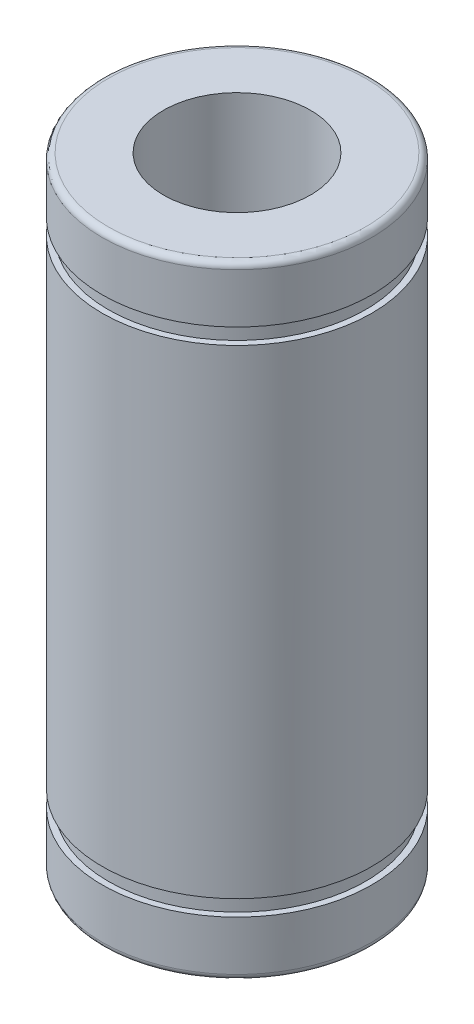
from build123d import *

# Parameters (mm, degrees)
ESBO_O1_R                = 11
ESBO_O1_R_2              = 6
RESSALTO_EXTRUS_O1_DEPTH = 50.8
CORTE_EXTRUS_O1_START    = -5.85
ESBO_O2_R                = 11
ESBO_O2_R_2              = 10.5
CORTE_EXTRUS_O1_DEPTH    = 1.3
CORTE_EXTRUS_O2_START    = -4.55
ESBO_O3_R                = 11
ESBO_O3_R_2              = 10.5
CORTE_EXTRUS_O2_DEPTH    = 1.3
FILETE1_R                = 0.5


with BuildPart() as part:
    # Esboço1 → Ressalto-extrusão1 (new body)
    with BuildSketch(Plane(origin=(0, 0, 0), x_dir=(1, 0, 0), z_dir=(0, 1, 0))):
        with Locations(Location((0, 0, 0), (0, 0, 270))):
            Circle(ESBO_O1_R)
        with Locations(Location((0, 0, 0), (0, 0, 270))):
            Circle(ESBO_O1_R_2, mode=Mode.SUBTRACT)
    extrude(amount=RESSALTO_EXTRUS_O1_DEPTH)

    # Esboço2 → Corte-extrusão1 (cut)
    with BuildSketch(Plane(origin=(0, 50.8, 0), x_dir=(1, 0, 0), z_dir=(0, 1, 0)).offset(CORTE_EXTRUS_O1_START)):
        with Locations(Location((0, 0, 0), (0, 0, 270))):
            Circle(ESBO_O2_R)
        with Locations(Location((0, 0, 0), (0, 0, 270))):
            Circle(ESBO_O2_R_2, mode=Mode.SUBTRACT)
    extrude(amount=CORTE_EXTRUS_O1_DEPTH, mode=Mode.SUBTRACT)

    # Esboço3 → Corte-extrusão2 (cut)
    with BuildSketch(Plane.XZ.offset(CORTE_EXTRUS_O2_START)):
        with Locations(Location((0, 0, 0), (0, 0, 270))):
            Circle(ESBO_O3_R)
        with Locations(Location((0, 0, 0), (0, 0, 90))):
            Circle(ESBO_O3_R_2, mode=Mode.SUBTRACT)
    extrude(amount=-CORTE_EXTRUS_O2_DEPTH, mode=Mode.SUBTRACT)

    # Filete1
    filete1_edges = [part.edges().sort_by_distance(p)[0] for p in [
        (0, 0, -11),
        (0, 50.8, -11),
    ]]
    fillet(filete1_edges, radius=FILETE1_R)


solid = part.part
